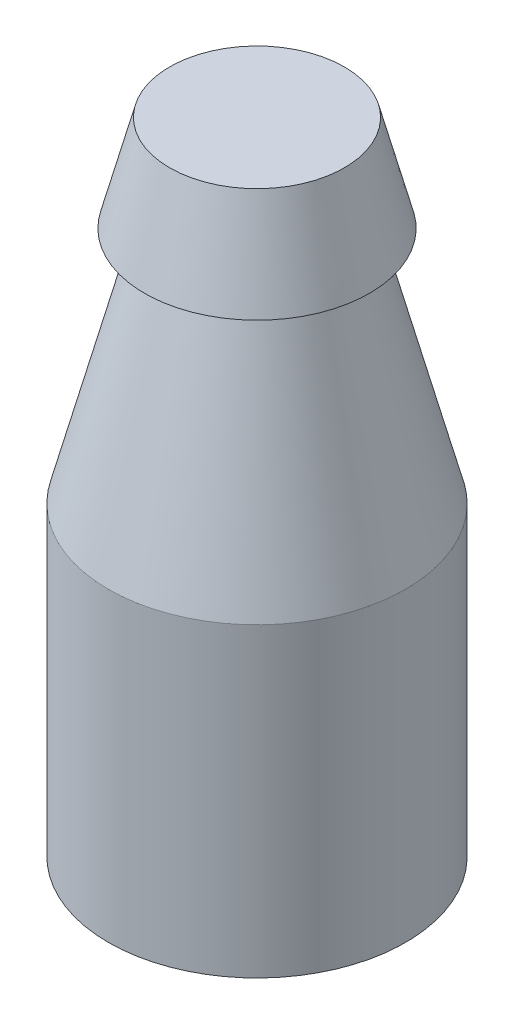
from build123d import *


with BuildPart() as part:
    # Sketch1 → Revolve1 (revolve)
    with BuildSketch(Plane.XY, mode=Mode.PRIVATE) as revolve1_sk:
        Polygon((0, -27.336018287), (-34, -27.336018287), (-34, 42.663981713), (-19.75, 97.185720844), (-25.75, 97.185720844), (-20, 119.185720844), (0, 119.185720844), align=None)
    revolve(revolve1_sk.sketch.rotate(Axis((0, -27.336018287, 0), (0, 1, 0)), 270), axis=Axis((0, -27.336018287, 0), (0, 1, 0)))


solid = part.part
